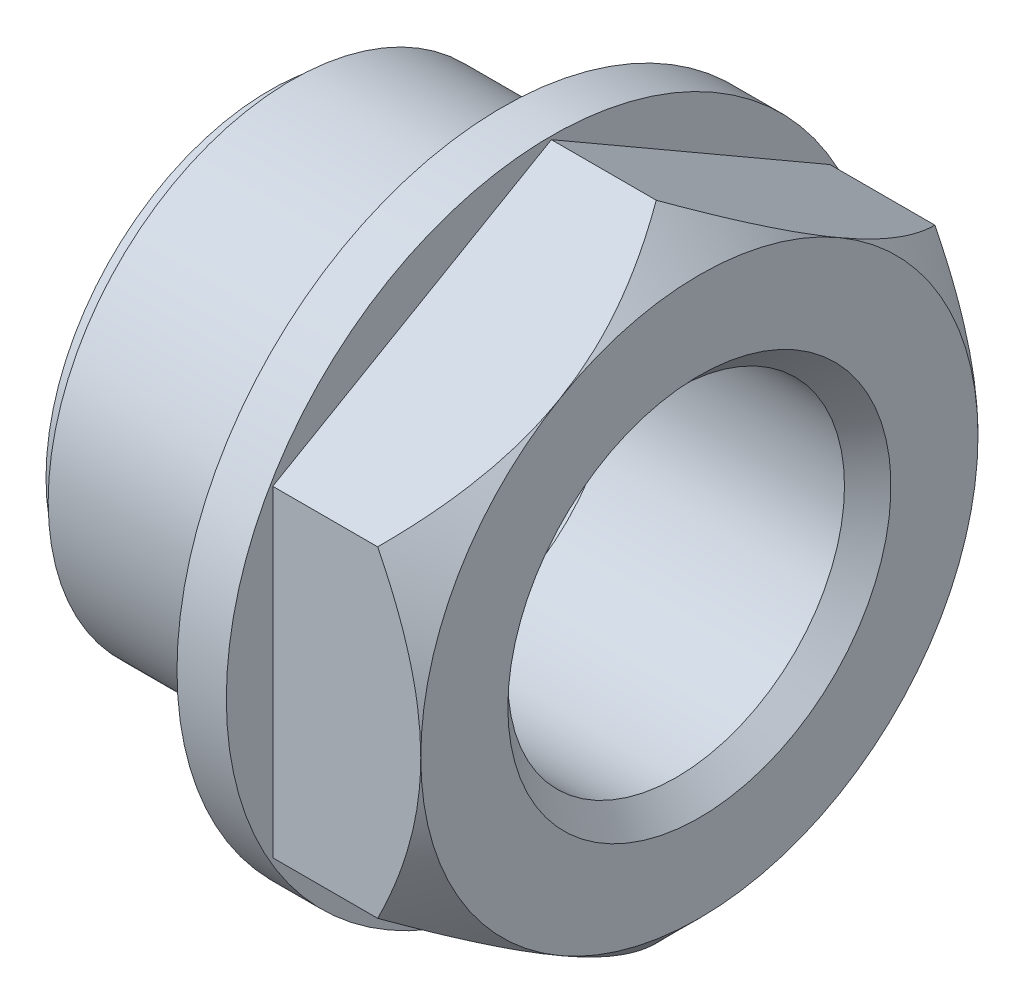
from build123d import *

# Parameters (mm, degrees)
TAGLIO_ESTRUSIONE1_DEPTH      = 6.375
TAGLIO_ESTRUSIONE1_DEPTH_BACK = 6.375
TAGLIO_ESTRUSIONE2_DEPTH      = 6.375
TAGLIO_ESTRUSIONE2_DEPTH_BACK = 6.375


with BuildPart() as part:
    # Schizzo1 → Rivoluzione1 (revolve)
    with BuildSketch(Plane.XY):
        Polygon((0, 8.25), (7.692307692, 8.25), (7.692307692, 7.25), (17.5, 7.25), (18.5, 8.25), (18.5, 12), (16.5, 14), (10, 14), (10, 10.48), (0.931555556, 10.48), (0.931555556, 9.6416), (0, 9.6416), align=None)
    revolve(axis=Axis((18.5, 0, 0), (-1, 0, 0)))

    # Schizzo2 → Taglio-Estrusione1 (cut, two sides: drawn at the far end of the back side and taken through both)
    with BuildSketch(Plane(origin=(18.5, 0, 0), x_dir=(0, 0, -1), z_dir=(1, 0, 0)).offset(-TAGLIO_ESTRUSIONE1_DEPTH_BACK)):
        Polygon((-18, -10.392304845), (1, -21.36195996), (1, -14.43375673), (-12, -6.92820323), (-12, 6.92820323), (1, 14.43375673), (1, 21.36195996), (-18, 10.392304845), align=None)
    extrude(amount=TAGLIO_ESTRUSIONE1_DEPTH + TAGLIO_ESTRUSIONE1_DEPTH_BACK, mode=Mode.SUBTRACT)

    # Schizzo3 → Taglio-Estrusione2 (cut, two sides: drawn at the far end of the back side and taken through both)
    with BuildSketch(Plane(origin=(18.5, 0, 0), x_dir=(0, 0, -1), z_dir=(1, 0, 0)).offset(-TAGLIO_ESTRUSIONE2_DEPTH_BACK)):
        Polygon((-1, -14.43375673), (-1, -21.36195996), (18, -10.392304845), (18, 10.392304845), (-1, 21.36195996), (-1, 14.43375673), (12, 6.92820323), (12, -6.92820323), align=None)
    extrude(amount=TAGLIO_ESTRUSIONE2_DEPTH + TAGLIO_ESTRUSIONE2_DEPTH_BACK, mode=Mode.SUBTRACT)


solid = part.part
